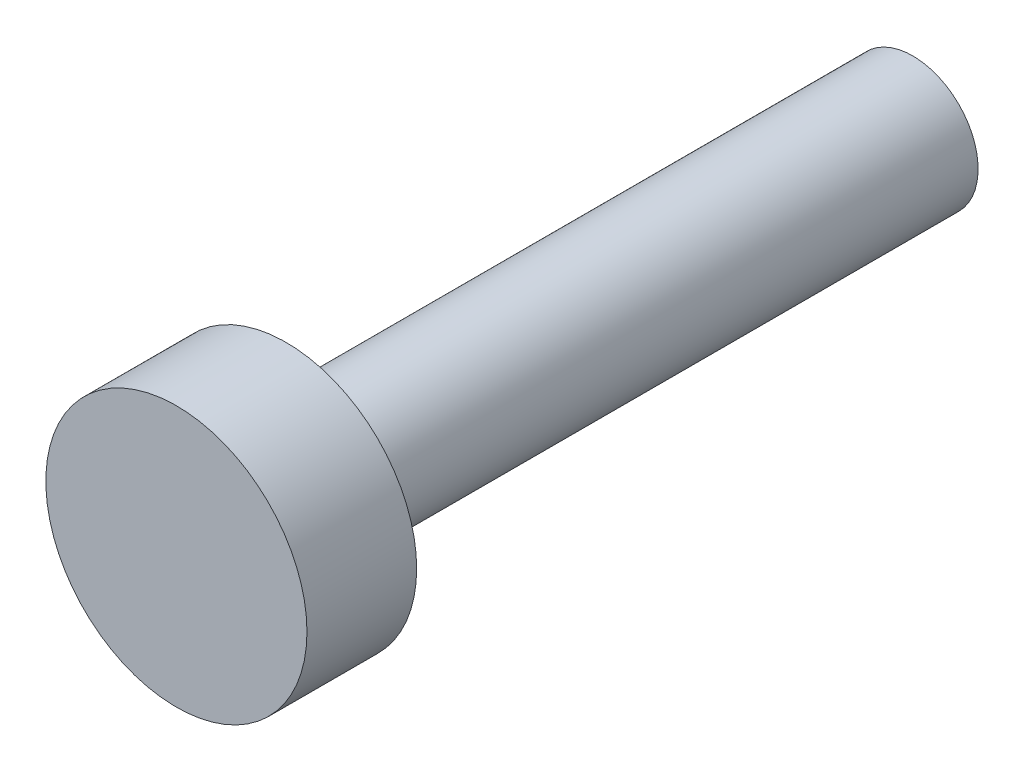
from build123d import *

# Parameters (mm, degrees)
ESQUISSE1_R        = 2.5
BOSS_EXTRU_1_DEPTH = 2.1
ESQUISSE2_R        = 1.25
BOSS_EXTRU_2_DEPTH = 12


with BuildPart() as part:
    # Esquisse1 → Boss.-Extru.1 (new body)
    with BuildSketch(Plane.XY):
        Circle(ESQUISSE1_R)
    extrude(amount=BOSS_EXTRU_1_DEPTH)

    # Esquisse2 → Boss.-Extru.2 (add)
    with BuildSketch(Plane(origin=(0, 0, 0), x_dir=(-1, 0, 0), z_dir=(0, 0, -1))):
        Circle(ESQUISSE2_R)
    extrude(amount=BOSS_EXTRU_2_DEPTH)


solid = part.part
